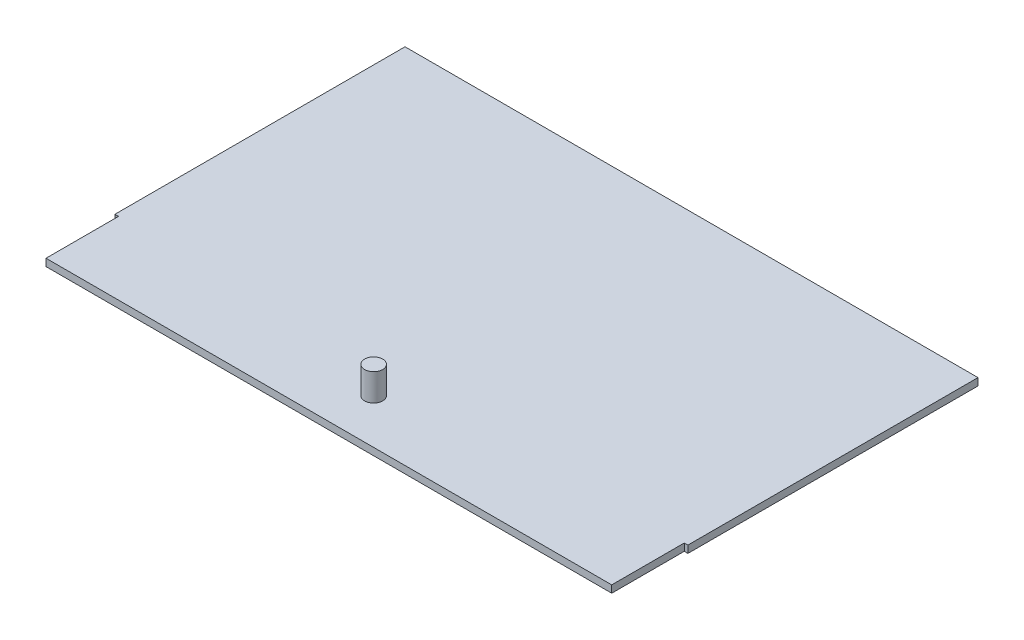
from build123d import *

# Parameters (mm, degrees)
BOSS_EXTRUDE1_DEPTH = 2
SKETCH2_R           = 2.5
BOSS_EXTRUDE2_DEPTH = 7.5


with BuildPart() as part:
    # Sketch1 → Boss-Extrude1 (new body)
    with BuildSketch(Plane(origin=(0, 0, 0), x_dir=(1, 0, 0), z_dir=(0, 1, 0))):
        Polygon((-5.476041667, 107.710069444), (-5.476041667, 27.710069444), (-4.476041667, 27.710069444), (-4.476041667, 7.710069444), (151.523958333, 7.710069444), (151.523958333, 27.710069444), (152.523958333, 27.710069444), (152.523958333, 107.710069444), align=None)
    extrude(amount=BOSS_EXTRUDE1_DEPTH)

    # Sketch2 → Boss-Extrude2 (add)
    with BuildSketch(Plane(origin=(0, 2, 0), x_dir=(1, 0, 0), z_dir=(0, 1, 0))):
        with Locations(Location((73.523958333, 20.058282781, 0), (0, 0, 90))):
            Circle(SKETCH2_R)
    extrude(amount=BOSS_EXTRUDE2_DEPTH)


solid = part.part
